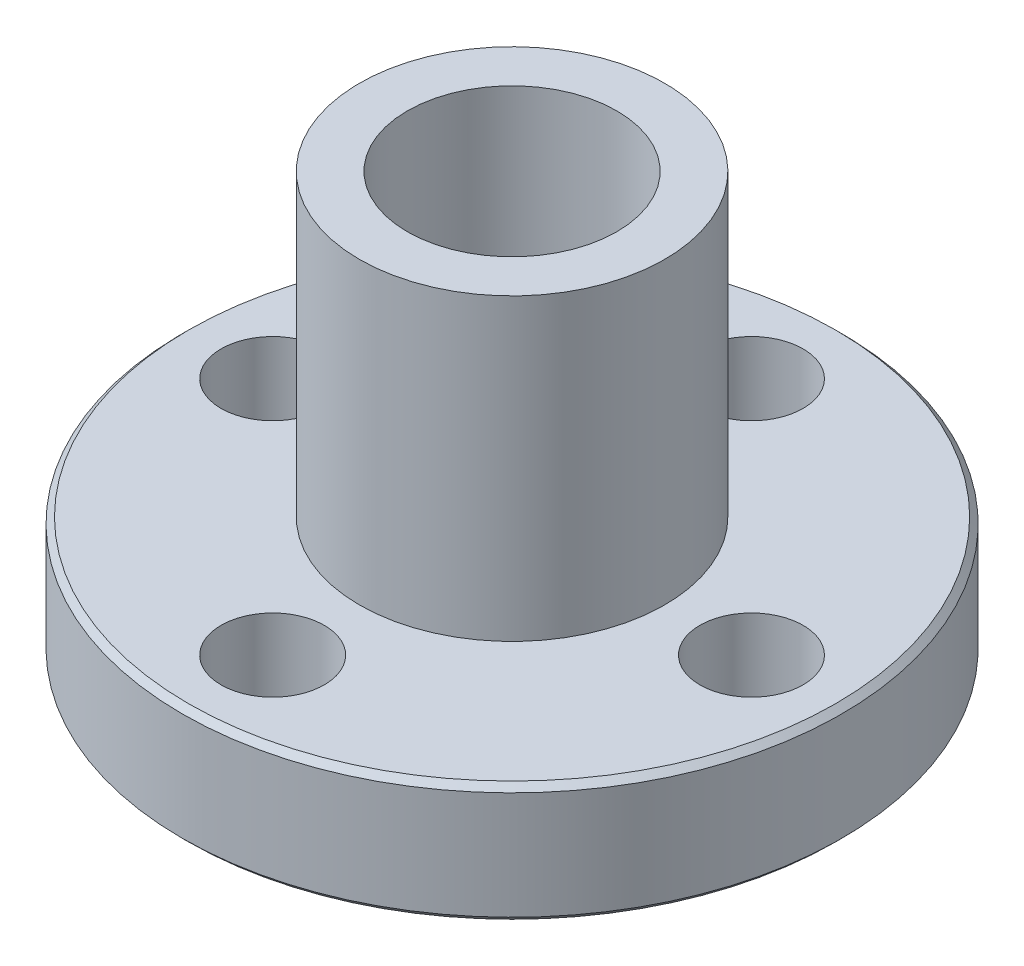
from build123d import *

# Parameters (mm, degrees)
SKETCH1_R           = 11.012952637
SKETCH1_R_2         = 3.5
BOSS_EXTRUDE1_DEPTH = 4
SKETCH3_R           = 5.1
SKETCH3_R_2         = 3.5
BOSS_EXTRUDE2_DEPTH = 10
BOSS_EXTRUDE3_START = 1.25
SKETCH4_R           = 5.125
SKETCH4_R_2         = 3.5
BOSS_EXTRUDE3_DEPTH = 1.25
CHAMFER1_SIZE       = 0.2
SKETCH2_R           = 1.725
CUT_EXTRUDE1_DEPTH  = 10


with BuildPart() as part:
    # Sketch1 → Boss-Extrude1 (new body)
    with BuildSketch(Plane(origin=(0, 0, 0), x_dir=(1, 0, 0), z_dir=(0, 1, 0))):
        with Locations(Location((0, 0, 0), (0, 0, 270))):
            Circle(SKETCH1_R)
        with Locations(Location((0, 0, 0), (0, 0, 270))):
            Circle(SKETCH1_R_2, mode=Mode.SUBTRACT)
    extrude(amount=BOSS_EXTRUDE1_DEPTH)

    # Sketch3 → Boss-Extrude2 (add)
    with BuildSketch(Plane(origin=(0, 4, 0), x_dir=(1, 0, 0), z_dir=(0, 1, 0))):
        with Locations(Location((0, 0, 0), (0, 0, 270))):
            Circle(SKETCH3_R)
        with Locations(Location((0, 0, 0), (0, 0, 270))):
            Circle(SKETCH3_R_2, mode=Mode.SUBTRACT)
    extrude(amount=BOSS_EXTRUDE2_DEPTH)

    # Sketch4 → Boss-Extrude3 (add)
    with BuildSketch(Plane(origin=(0, 0, 0), x_dir=(-1, 0, 0), z_dir=(0, -1, 0)).offset(BOSS_EXTRUDE3_START)):
        with Locations(Location((0, 0, 0), (0, 0, 270))):
            Circle(SKETCH4_R)
        with Locations(Location((0, 0, 0), (0, 0, 90))):
            Circle(SKETCH4_R_2, mode=Mode.SUBTRACT)
    extrude(amount=-BOSS_EXTRUDE3_DEPTH)

    # Chamfer1
    chamfer1_edges = [part.edges().sort_by_distance(p)[0] for p in [
        (0, 0, -11.012952637),
        (0, 4, -11.012952637),
    ]]
    chamfer(chamfer1_edges, length=CHAMFER1_SIZE)

    # Sketch2 → Cut-Extrude1 (cut)
    with BuildSketch(Plane(origin=(0, 4, 0), x_dir=(1, 0, 0), z_dir=(0, 1, 0))):
        with Locations(Location((8, 0, 0), (0, 0, 270))):
            Circle(SKETCH2_R)
        with Locations(Location((0, -8, 0), (0, 0, 270))):
            Circle(SKETCH2_R)
        with Locations(Location((-8, 0, 0), (0, 0, 270))):
            Circle(SKETCH2_R)
        with Locations(Location((0, 8, 0), (0, 0, 270))):
            Circle(SKETCH2_R)
    extrude(amount=-CUT_EXTRUDE1_DEPTH, mode=Mode.SUBTRACT)


solid = part.part
